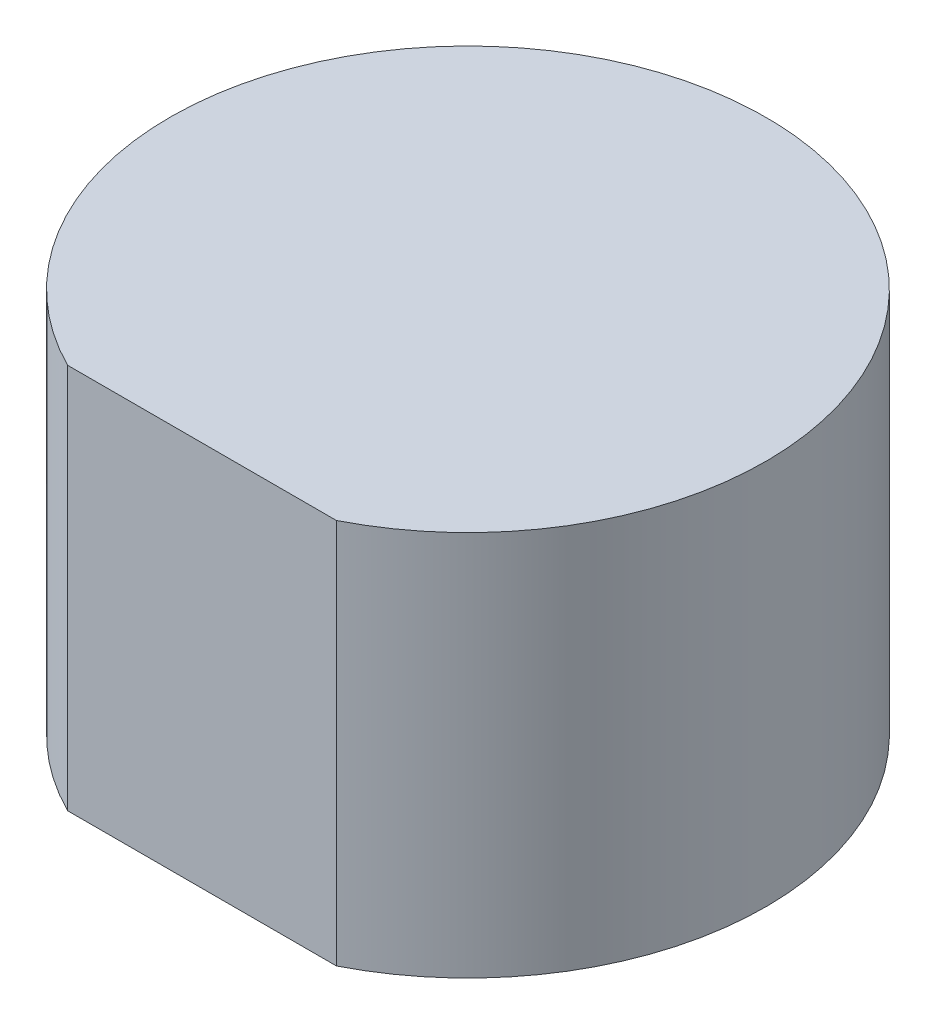
from build123d import *

# Parameters (mm, degrees)
BOSS_EXTRUDE1_DEPTH = 33


with BuildPart() as part:
    # Sketch1 → Boss-Extrude1 (new body)
    with BuildSketch(Plane(origin=(0, 0, 0), x_dir=(1, 0, 0), z_dir=(0, 1, 0))):
        with BuildLine():
            Line((11.5, -22.748408736), (-11.5, -22.748408736))
            ThreePointArc((-11.5, -22.748408736), (0, 25.49), (11.5, -22.748408736))
        make_face()
    extrude(amount=BOSS_EXTRUDE1_DEPTH)


solid = part.part
